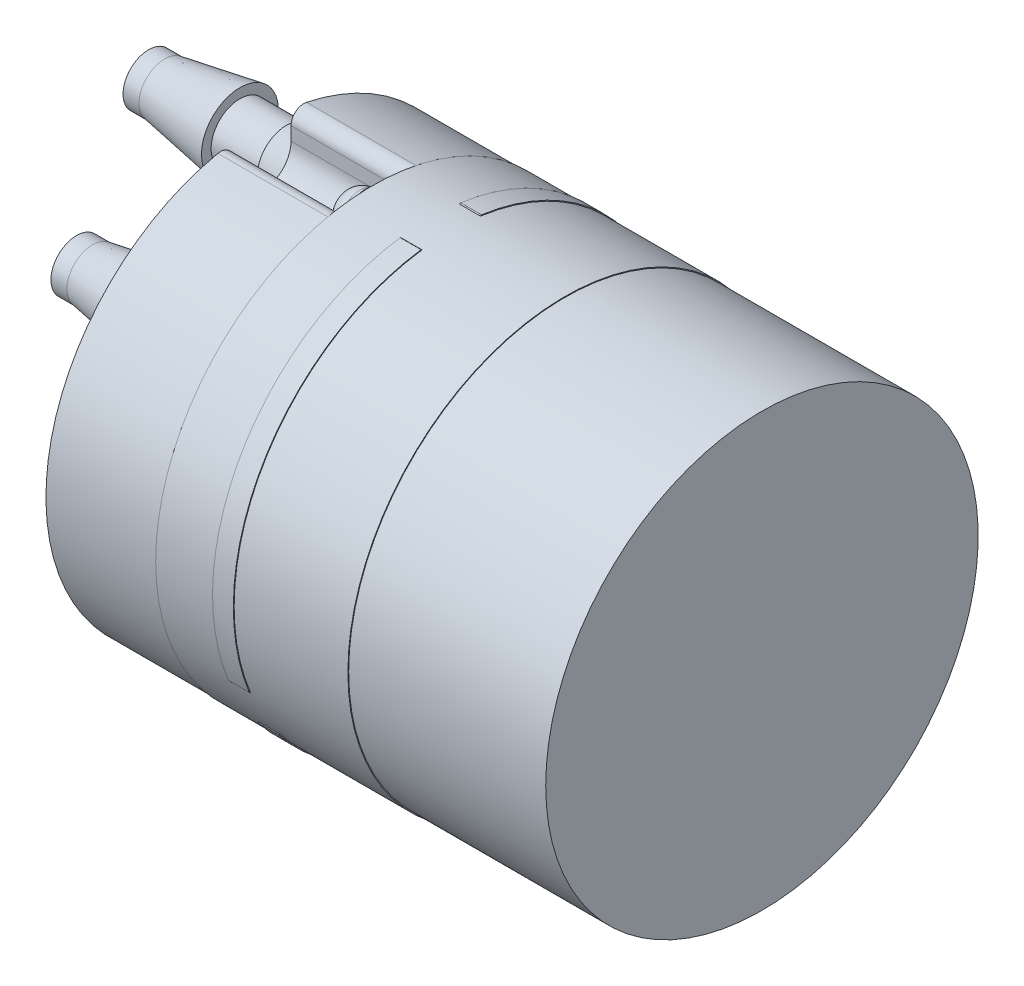
from build123d import *

# Parameters (mm, degrees)
PUMP_OD_SKETCH_R          = 13.5
PUMP_OD_EXTRUDE_DEPTH     = 31.2
PUMP_START                = 12.3
PUMP_MIDDLE_SKETCH_R      = 13.55
PUMP_MIDDLE_EXTRUDE_DEPTH = 12
DIAPHRAGM_START           = -3.6
DIAPHRAGM_EXTRUDE_DEPTH   = 1.3
SCREW_POCKET_CUT_DEPTH    = 6.9
SCREW_POCKET_FILLET_R     = 0.8
SCEW_HEAD_SKETCH_R        = 1.3
SCREW_HEAD_EXTRUDE_DEPTH  = 1.8
SCREW_HEAD_FILLET_R       = 1
SCREW_DRIVE_CUT_DEPTH     = 1
WASHER_SKETCH_R           = 1.581796131
WASHER_EXTRUDE_DEPTH      = 0.4
NOZZLE_LPATTERN_COUNT     = 2
NOZZLE_LPATTERN_PITCH     = 9


with BuildPart() as part:
    # Pump OD Sketch → Pump OD Extrude (new body)
    with BuildSketch(Plane.ZY.offset(31)):
        Circle(PUMP_OD_SKETCH_R)
    extrude(amount=PUMP_OD_EXTRUDE_DEPTH)

    # Pump Middle Sketch → Pump Middle Extrude (add)
    with BuildSketch(Plane.ZY.offset(31).offset(PUMP_START)):
        Circle(PUMP_MIDDLE_SKETCH_R)
    extrude(amount=PUMP_MIDDLE_EXTRUDE_DEPTH)

    # Diaphragm Sketch → Diaphragm Extrude (add)
    with BuildSketch(Plane.ZY.offset(55.3).offset(DIAPHRAGM_START)):
        with BuildLine():
            Line((-1.825, 12.291819434), (1.825, 12.291819434))
            Line((1.825, 12.291819434), (1.825, 13.408145845))
            ThreePointArc((1.825, 13.408145845), (1.845637465, 13.453429295), (1.893353028, 13.467561558))
            ThreePointArc((1.893353028, 13.467561558), (11.777945491, 6.8), (12.60992695, -5.094088958))
            ThreePointArc((12.60992695, -5.094088958), (12.57383027, -5.128345717), (12.524294919, -5.123576561))
            Line((12.524294919, -5.123576561), (11.557527888, -4.565413355))
            Line((11.557527888, -4.565413355), (9.732527888, -7.726406079))
            Line((9.732527888, -7.726406079), (10.699294919, -8.284569284))
            ThreePointArc((10.699294919, -8.284569284), (10.728192805, -8.325083578), (10.716573922, -8.373472599))
            ThreePointArc((10.716573922, -8.373472599), (0, -13.6), (-10.716573922, -8.373472599))
            ThreePointArc((-10.716573922, -8.373472599), (-10.728192805, -8.325083578), (-10.699294919, -8.284569284))
            Line((-10.699294919, -8.284569284), (-9.732527888, -7.726406079))
            Line((-9.732527888, -7.726406079), (-11.557527888, -4.565413355))
            Line((-11.557527888, -4.565413355), (-12.524294919, -5.123576561))
            ThreePointArc((-12.524294919, -5.123576561), (-12.57383027, -5.128345717), (-12.60992695, -5.094088958))
            ThreePointArc((-12.60992695, -5.094088958), (-11.777945491, 6.8), (-1.893353028, 13.467561558))
            ThreePointArc((-1.893353028, 13.467561558), (-1.845637465, 13.453429295), (-1.825, 13.408145845))
            Line((-1.825, 13.408145845), (-1.825, 12.291819434))
        make_face()
    extrude(amount=-DIAPHRAGM_EXTRUDE_DEPTH)

    # Screw Pocket Sketch → Screw Pocket Cut (cut)
    with BuildSketch(Plane.ZY.offset(62.2)):
        with BuildLine():
            Line((-1.8, 11.6), (-1.8, 15.537585437))
            Line((-1.8, 15.537585437), (1.8, 15.537585437))
            Line((1.8, 15.537585437), (1.8, 11.6))
            ThreePointArc((1.8, 11.6), (0, 9.8), (-1.8, 11.6))
        make_face()
    extrude(amount=-SCREW_POCKET_CUT_DEPTH, mode=Mode.SUBTRACT)

    # Screw Pocket Fillet
    screw_pocket_fillet_edges = [part.edges().sort_by_distance(p)[0] for p in [
        (-58.75, 13.379461873, -1.8),
        (-58.75, 13.379461873, 1.8),
    ]]
    fillet(screw_pocket_fillet_edges, radius=SCREW_POCKET_FILLET_R)

    # Scew Head Sketch → Screw Head Extrude (add)
    with BuildSketch(Plane.ZY.offset(55.3)):
        with Locations((0, 11.6)):
            Circle(SCEW_HEAD_SKETCH_R)
    extrude(amount=SCREW_HEAD_EXTRUDE_DEPTH)

    # Screw Head Fillet
    screw_head_fillet_edges = [part.edges().sort_by_distance(p)[0] for p in [
        (-57.1, 11.6, -1.3),
    ]]
    fillet(screw_head_fillet_edges, radius=SCREW_HEAD_FILLET_R)

    # Sketch10 → Screw Drive Cut (cut)
    with BuildSketch(Plane.ZY.offset(57.1)):
        Polygon((0.15, 11.75), (0.15, 12.4), (-0.15, 12.4), (-0.15, 11.75), (-0.8, 11.75), (-0.8, 11.45), (-0.15, 11.45), (-0.15, 10.8), (0.15, 10.8), (0.15, 11.45), (0.8, 11.45), (0.8, 11.75), align=None)
    extrude(amount=-SCREW_DRIVE_CUT_DEPTH, mode=Mode.SUBTRACT)

    # Washer Sketch → Washer Extrude (add)
    with BuildSketch(Plane.ZY.offset(55.3)):
        with Locations((0, 11.6)):
            Circle(WASHER_SKETCH_R)
    extrude(amount=WASHER_EXTRUDE_DEPTH)

    # Center Nozzle Sketch → Center Nozzle Revolve (revolve)
    with BuildSketch(Plane.XY, mode=Mode.PRIVATE) as center_nozzle_revolve_sk:
        Polygon((-73.789716671, 1.6), (-72.789716671, 1.6), (-68.089716671, 2.4), (-68.089716671, 1.8), (-65.2, 1.8), (-62.2, 2.7), (-62.2, 1), (-73.789716671, 1), align=None)
    center_nozzle_revolve = revolve(center_nozzle_revolve_sk.sketch.rotate(Axis((0, 0, 0), (-1, 0, 0)), 90), axis=Axis((0, 0, 0), (-1, 0, 0)))

    # Nozzle LPattern: Center Nozzle Revolve ×2
    with Locations(*[Vector(0, 0.8660254037844379, -0.5000000000000012) * (i * NOZZLE_LPATTERN_PITCH) for i in range(1, NOZZLE_LPATTERN_COUNT)]):
        add(center_nozzle_revolve)


solid = part.part
